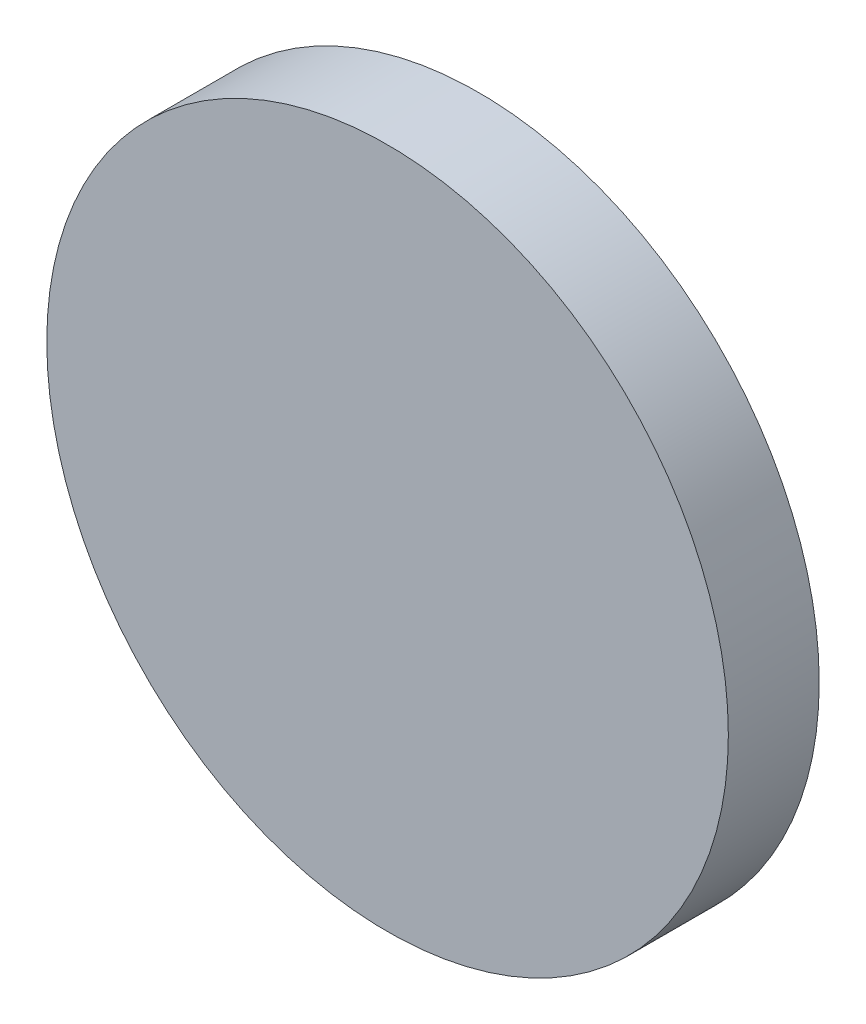
from build123d import *

# Parameters (mm, degrees)
SKETCH_1_R      = 3.75
EXTRUDE_1_DEPTH = 1


with BuildPart() as part:
    # 草图1 → 凸台-拉伸1 (new body)
    with BuildSketch(Plane.XY):
        Circle(SKETCH_1_R)
    extrude(amount=EXTRUDE_1_DEPTH)


solid = part.part
